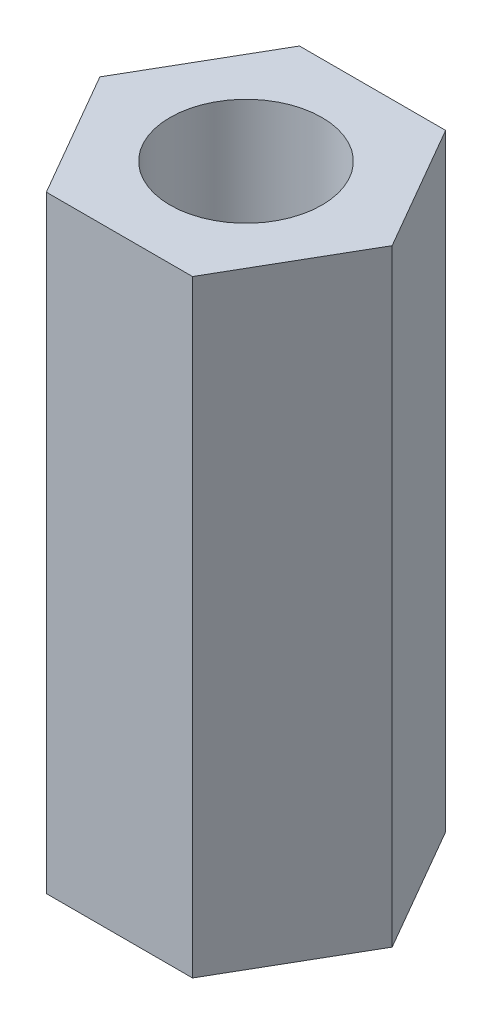
from build123d import *

# Parameters (mm, degrees)
SKETCH2_R           = 1.5
BOSS_EXTRUDE1_DEPTH = 12


with BuildPart() as part:
    # Sketch2 → Boss-Extrude1 (new body)
    with BuildSketch(Plane(origin=(0, 0, 0), x_dir=(1, 0, 0), z_dir=(0, 1, 0))):
        Polygon((1.4435, 2.500215341), (2.887, 0), (1.4435, -2.500215341), (-1.4435, -2.500215341), (-2.887, 0), (-1.4435, 2.500215341), align=None)
        with Locations(Location((0, 0, 0), (0, 0, 270))):
            Circle(SKETCH2_R, mode=Mode.SUBTRACT)
    extrude(amount=BOSS_EXTRUDE1_DEPTH)


solid = part.part
